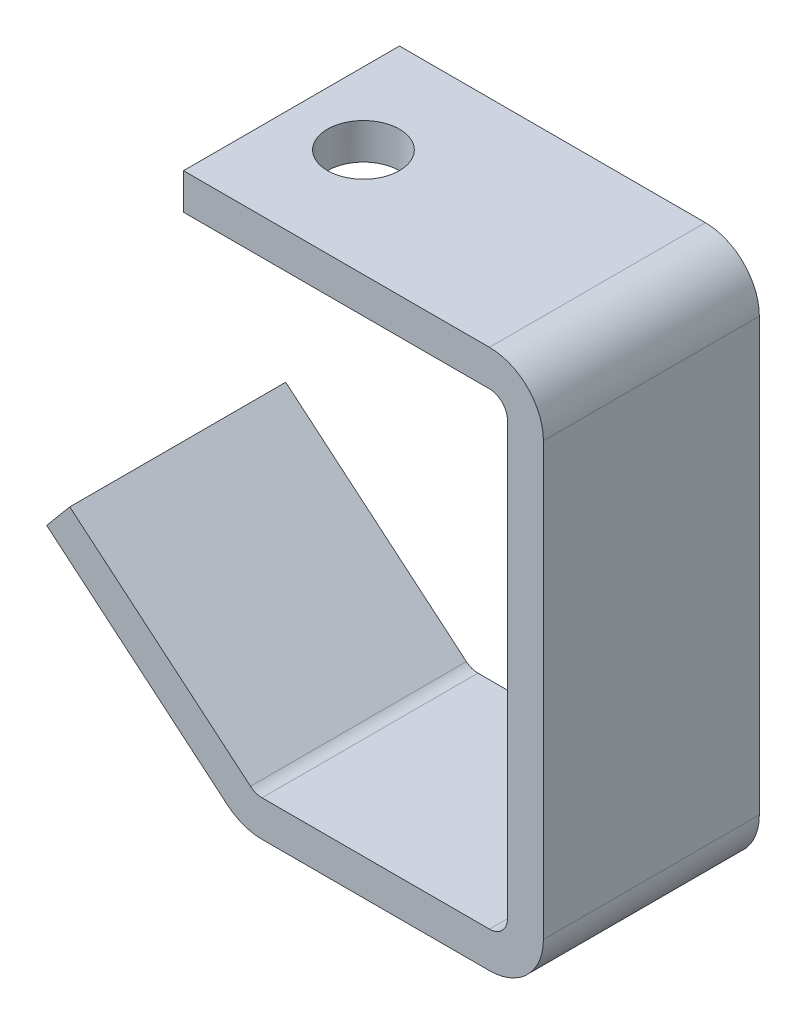
from build123d import *

# Parameters (mm, degrees)
EXTRUDE_THIN1_DEPTH = 19.05
SKETCH2_R           = 6.35
CUT_EXTRUDE1_DEPTH  = 10


with BuildPart() as part:
    # Sketch1 → Extrude-Thin1 (new, symmetric)
    with BuildSketch(Plane.XY):
        with BuildLine():
            Line((-77.216, 27.494), (-45.335245866, 0.74281114))
            ThreePointArc((-45.335245866, 0.74281114), (-44.380308124, 0.191476527), (-43.294392527, 0))
            Line((-43.294392527, 0), (-3.175, 0))
            ThreePointArc((-3.175, 0), (-0.92993597, 0.92993597), (0, 3.175))
            Line((0, 3.175), (0, 79.375))
            ThreePointArc((0, 79.375), (-0.92993597, 81.62006403), (-3.175, 82.55))
            Line((-3.175, 82.55), (-57.15, 82.55))
            Line((-57.15, 82.55), (-57.15, 88.9))
            Line((-57.15, 88.9), (-3.175, 88.9))
            ThreePointArc((-3.175, 88.9), (3.560192091, 86.110192091), (6.35, 79.375))
            Line((6.35, 79.375), (6.35, 3.175))
            ThreePointArc((6.35, 3.175), (3.560192091, -3.560192091), (-3.175, -6.35))
            Line((-3.175, -6.35), (-43.294392527, -6.35))
            ThreePointArc((-43.294392527, -6.35), (-46.55213932, -5.775570419), (-49.416952544, -4.121566579))
            Line((-49.416952544, -4.121566579), (-81.297706678, 22.629622281))
            Line((-81.297706678, 22.629622281), (-77.216, 27.494))
        make_face()
    extrude(amount=EXTRUDE_THIN1_DEPTH, both=True)

    # Sketch2 → Cut-Extrude1 (cut)
    with BuildSketch(Plane(origin=(0, 88.9, 0), x_dir=(1, 0, 0), z_dir=(0, 1, 0))):
        with Locations(Location((-44.45, 0, 0), (0, 0, 270))):
            Circle(SKETCH2_R)
    extrude(amount=-CUT_EXTRUDE1_DEPTH, mode=Mode.SUBTRACT)


solid = part.part
